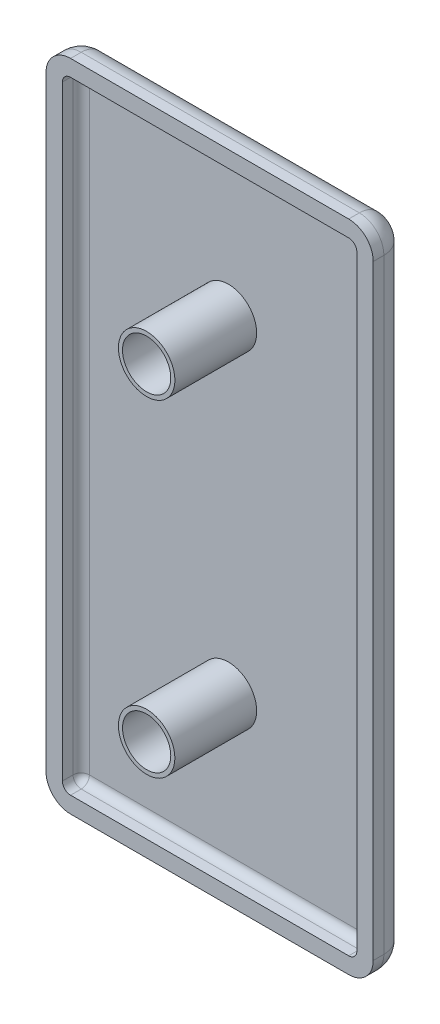
from build123d import *

# Parameters (mm, degrees)
EXTRUDE_1_DEPTH = 4.3
FILLET_1_R      = 3
SHELL_1_T       = -2
SKETCH_3_R      = 3.45
SKETCH_3_R_2    = 2.95
EXTRUDE_2_DEPTH = 10


with BuildPart() as part:
    # 草图1 → 凸台-拉伸1 (new body)
    with BuildSketch(Plane.XY):
        with BuildLine():
            Line((3, 0), (37, 0))
            ThreePointArc((37, 0), (39.121320344, 0.878679656), (40, 3))
            Line((40, 3), (40, 77))
            ThreePointArc((40, 77), (39.121320344, 79.121320344), (37, 80))
            Line((37, 80), (3, 80))
            ThreePointArc((3, 80), (0.878679656, 79.121320344), (0, 77))
            Line((0, 77), (0, 3))
            ThreePointArc((0, 3), (0.878679656, 0.878679656), (3, 0))
        make_face()
    extrude(amount=EXTRUDE_1_DEPTH)

    # 圆角1
    fillet_1_edges = [part.edges().sort_by_distance(p)[0] for p in [
        (20, 0, 0),
        (0.878679656, 0.878679656, 0),
        (0, 40, 0),
        (0.878679656, 79.121320344, 0),
        (20, 80, 0),
        (39.121320344, 79.121320344, 0),
        (40, 40, 0),
        (39.121320344, 0.878679656, 0),
    ]]
    fillet(fillet_1_edges, radius=FILLET_1_R)

    # 抽壳1
    shell_1_openings = [part.faces().sort_by_distance(p)[0] for p in [
        (20, 40, 4.3),
    ]]
    offset(amount=SHELL_1_T, openings=shell_1_openings, kind=Kind.INTERSECTION)

    # 草图3 → 凸台-拉伸2 (add)
    # profile 1 of 2: a face of its own
    with BuildSketch(Plane.XY.offset(2)):
        with Locations((20, 20)):
            Circle(SKETCH_3_R)
        with Locations((20, 20)):
            Circle(SKETCH_3_R_2, mode=Mode.SUBTRACT)
    # profile 2 of 2: a face of its own
    with BuildSketch(Plane.XY.offset(2)):
        with Locations(Location((20, 60, 0), (0, 0, 180))):
            Circle(SKETCH_3_R)
        with Locations(Location((20, 60, 0), (0, 0, 180))):
            Circle(SKETCH_3_R_2, mode=Mode.SUBTRACT)
    extrude(amount=EXTRUDE_2_DEPTH)


solid = part.part
